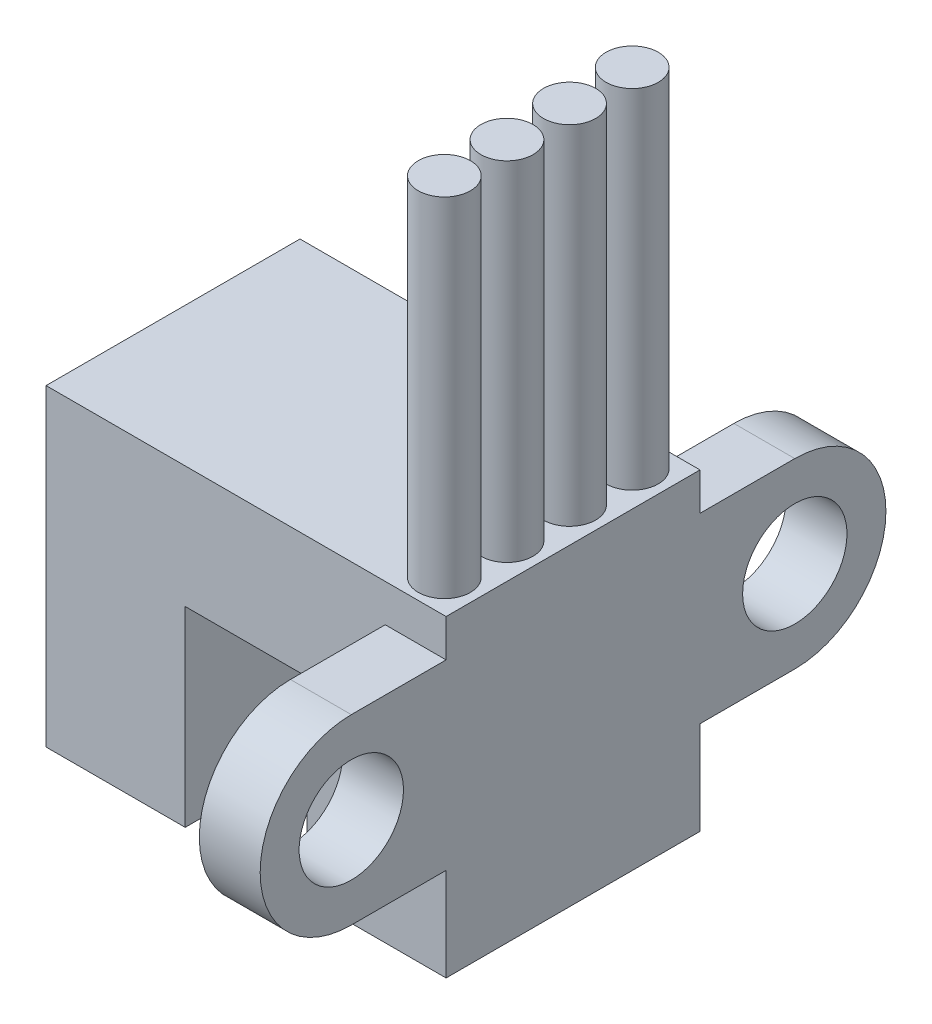
from build123d import *

# Parameters (mm, degrees)
BOSS_EXTRU_1_DEPTH = 3.65
ESQUISSE2_R        = 1.5
BOSS_EXTRU_2_DEPTH = 1.75
ESQUISSE3_R        = 0.75
BOSS_EXTRU_3_DEPTH = 10


with BuildPart() as part:
    # Esquisse1 → Boss.-Extru.1 (new, symmetric)
    with BuildSketch(Plane.XY):
        Polygon((1.75, 0), (-1.75, 0), (-1.75, -5.5), (-5.75, -5.5), (-5.75, 3.5), (5.75, 3.5), (5.75, -5.5), (1.75, -5.5), align=None)
    extrude(amount=BOSS_EXTRU_1_DEPTH, both=True)

    # Esquisse2 → Boss.-Extru.2 (add)
    with BuildSketch(Plane(origin=(5.75, 0, 0), x_dir=(0, 0, -1), z_dir=(1, 0, 0))):
        with BuildLine():
            Line((-6.375, 2.42), (-3.65, 2.42))
            Line((-3.65, 2.42), (-3.65, -2.82))
            Line((-3.65, -2.82), (-6.375, -2.82))
            ThreePointArc((-6.375, -2.82), (-8.995, -0.2), (-6.375, 2.42))
        make_face()
        with Locations((-6.375, -0.2)):
            Circle(ESQUISSE2_R, mode=Mode.SUBTRACT)
    boss_extru_2 = extrude(amount=-BOSS_EXTRU_2_DEPTH)

    # Symétrie1: Boss.-Extru.2 across plane
    add(boss_extru_2.mirror(Plane.XY))

    # Esquisse3 → Boss.-Extru.3 (add)
    with BuildSketch(Plane(origin=(0, 3.5, 0), x_dir=(1, 0, 0), z_dir=(0, 1, 0))):
        with Locations((4.75, 2.7)):
            Circle(ESQUISSE3_R)
        with Locations((4.75, 0.9)):
            Circle(ESQUISSE3_R)
        with Locations((4.75, -0.9)):
            Circle(ESQUISSE3_R)
        with Locations((4.75, -2.7)):
            Circle(ESQUISSE3_R)
    extrude(amount=BOSS_EXTRU_3_DEPTH)


solid = part.part
